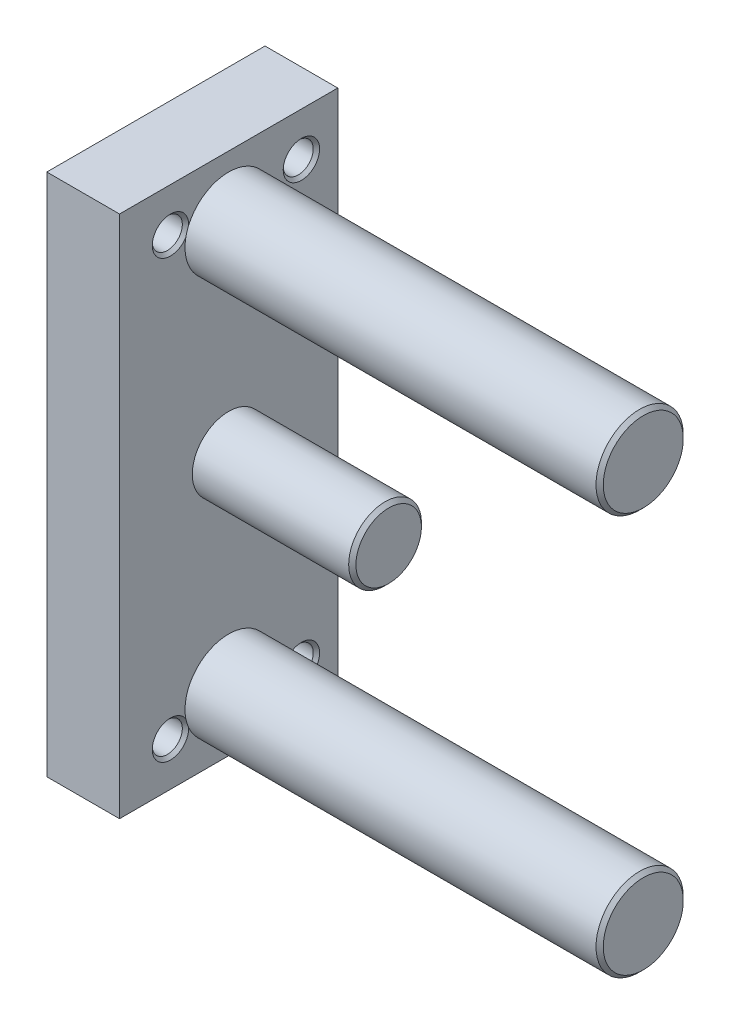
from build123d import *

# Parameters (mm, degrees)
SKETCH_1_W                  = 30
SKETCH_1_H                  = 72
EXTRUDE_1_DEPTH             = 10
PATTERN_LINEAR_1_COUNT      = 2
PATTERN_LINEAR_1_PITCH      = 18
PATTERN_LINEAR_1_COUNT_DIR2 = 2
PATTERN_LINEAR_1_PITCH_DIR2 = 60


with BuildPart() as part:
    # 草图1 → 凸台-拉伸1 (new body)
    with BuildSketch(Plane(origin=(0, 0, 0), x_dir=(0, 0, -1), z_dir=(1, 0, 0))):
        Rectangle(SKETCH_1_W, SKETCH_1_H)
    extrude(amount=EXTRUDE_1_DEPTH)

    # 草图2 → 切除-旋转1 (revolve, cut)
    with BuildSketch(Plane(origin=(0, 30, 0), x_dir=(1, 0, 0), z_dir=(0, 1, 0))):
        Polygon((0, 10), (0, 12.5), (0.433, 12.067), (9.567, 12.067), (10, 12.5), (10, 10), align=None)
    cut_revolve_1 = revolve(axis=Axis((10, 30, -10), (-1, 0, 0)), mode=Mode.SUBTRACT)

    # 阵列(线性)1: Cut-Revolve 1 2 × 2
    with Locations(*[(0, -j * PATTERN_LINEAR_1_PITCH_DIR2, i * PATTERN_LINEAR_1_PITCH) for i in range(PATTERN_LINEAR_1_COUNT) for j in range(PATTERN_LINEAR_1_COUNT_DIR2) if (i, j) != (0, 0)]):
        add(cut_revolve_1, mode=Mode.SUBTRACT)

    # 草图4 → 切除-旋转2 (revolve, cut)
    with BuildSketch(Plane(origin=(0, 27.5, 0), x_dir=(1, 0, 0), z_dir=(0, 1, 0))):
        Polygon((0, 0), (0, 3.8), (5.555555556, 3.8), (5.555555556, 3.5), (2.055555556, 3.5), (1.555555556, 3), (1.555555556, 1.5), (4.155555556, 1.5), (5.021580959, 0), align=None)
    revolve(axis=Axis((5.021580959, 27.5, 0), (-1, 0, 0)), mode=Mode.SUBTRACT)

    # 草图5 → 切除-旋转3 (revolve, cut)
    with BuildSketch(Plane(origin=(0, 0, 0), x_dir=(1, 0, 0), z_dir=(0, 1, 0))):
        Polygon((0, 0), (0, 3.8), (5.555555556, 3.8), (5.555555556, 3.5), (2.055555556, 3.5), (1.555555556, 3), (1.555555556, 1.5), (4.155555556, 1.5), (5.021580959, 0), align=None)
    revolve(axis=Axis((5.021580959, 0, 0), (-1, 0, 0)), mode=Mode.SUBTRACT)

    # 草图6 → 切除-旋转4 (revolve, cut)
    with BuildSketch(Plane(origin=(0, -27.5, 0), x_dir=(1, 0, 0), z_dir=(0, 1, 0))):
        Polygon((0, 0), (0, 3.8), (5.555555556, 3.8), (5.555555556, 3.5), (2.055555556, 3.5), (1.555555556, 3), (1.555555556, 1.5), (4.155555556, 1.5), (5.021580959, 0), align=None)
    revolve(axis=Axis((5.021580959, -27.5, 0), (-1, 0, 0)), mode=Mode.SUBTRACT)

    # 草图7 → 旋转1 (revolve)
    with BuildSketch(Plane(origin=(0, 0, 0), x_dir=(1, 0, 0), z_dir=(0, 1, 0))):
        Polygon((10, 0), (10, 5), (31.5, 5), (32, 4.5), (32, 0), align=None)
    revolve(axis=Axis((32, 0, 0), (-1, 0, 0)))

    # 草图8 → 旋转2 (revolve)
    with BuildSketch(Plane(origin=(0, -27.5, 0), x_dir=(1, 0, 0), z_dir=(0, 1, 0))):
        Polygon((10, 0), (10, 6), (66.5, 6), (67, 5.5), (67, 0), align=None)
    revolve(axis=Axis((67, -27.5, 0), (-1, 0, 0)))

    # 草图9 → 旋转3 (revolve)
    with BuildSketch(Plane(origin=(0, 27.5, 0), x_dir=(1, 0, 0), z_dir=(0, 1, 0))):
        Polygon((10, 0), (10, 6), (66.5, 6), (67, 5.5), (67, 0), align=None)
    revolve(axis=Axis((67, 27.5, 0), (-1, 0, 0)))


solid = part.part
